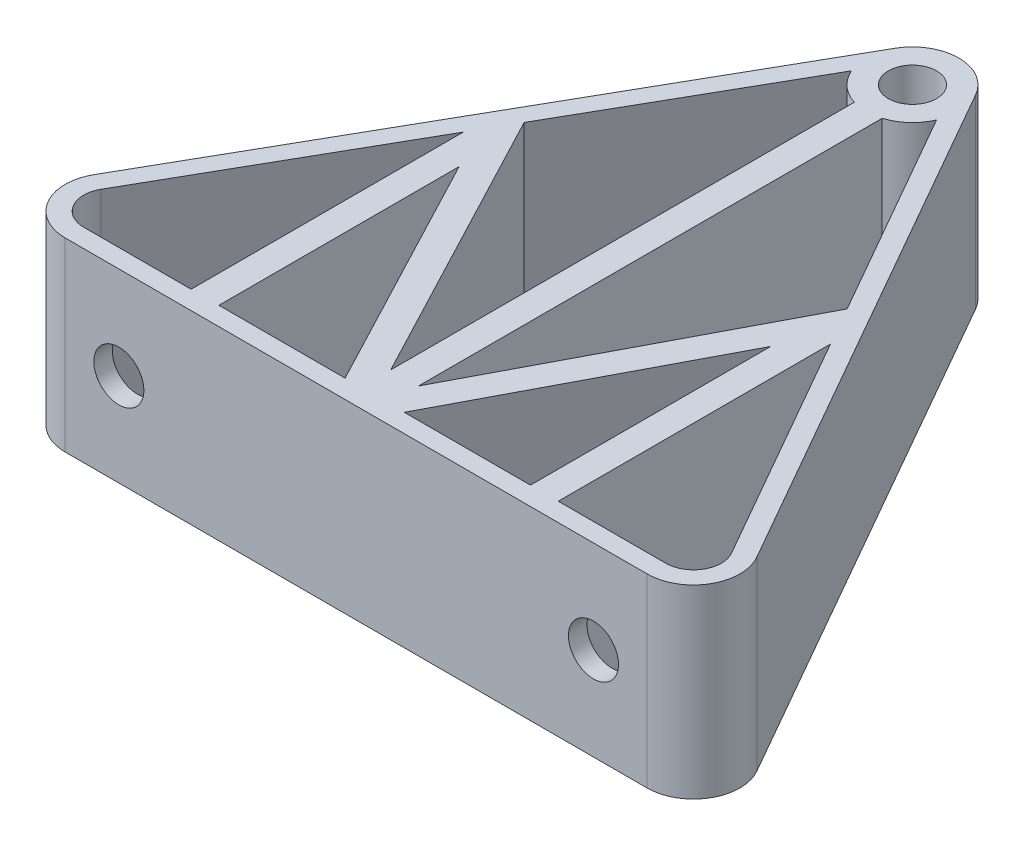
from build123d import *

# Parameters (mm, degrees)
SALIENTE_EXTRUIR1_DEPTH = 20
CORTAR_EXTRUIR1_START   = -20
CORTAR_EXTRUIR1_DEPTH   = 20
CROQUIS3_R              = 2.6
CORTAR_EXTRUIR2_DEPTH   = 20
CROQUIS4_R              = 2.7
CORTAR_EXTRUIR3_DEPTH   = 20


with BuildPart() as part:
    # Croquis1 → Saliente-Extruir1 (new body)
    with BuildSketch(Plane(origin=(0, 0, 0), x_dir=(1, 0, 0), z_dir=(0, 1, 0))):
        with BuildLine():
            Line((-4.342546511, 2.47836434), (-35.731971676, -52.52163566))
            ThreePointArc((-35.731971676, -52.52163566), (-35.713301997, -57.510794525), (-31.389425165, -60))
            Line((-31.389425165, -60), (31.389425165, -60))
            ThreePointArc((31.389425165, -60), (35.713301997, -57.510794525), (35.731971676, -52.52163566))
            Line((35.731971676, -52.52163566), (4.342546511, 2.47836434))
            ThreePointArc((4.342546511, 2.47836434), (0, 5), (-4.342546511, 2.47836434))
        make_face()
    extrude(amount=SALIENTE_EXTRUIR1_DEPTH)

    # Croquis2 → Cortar-Extruir1 (cut)
    with BuildSketch(Plane(origin=(0, 20, 0), x_dir=(1, 0, 0), z_dir=(0, 1, 0)).offset(CORTAR_EXTRUIR1_START)):
        with BuildLine():
            Line((-19.800240489, -58), (-19.800240489, -28.641255076))
            Line((-19.800240489, -28.641255076), (-33.994953072, -53.512981396))
            ThreePointArc((-33.994953072, -53.512981396), (-33.983751264, -56.506476715), (-31.389425165, -58))
            Line((-31.389425165, -58), (-19.800240489, -58))
        make_face()
        Polygon((-16.800240489, -58), (-3.194307375, -58), (-16.800240489, -32.094821088), align=None)
        with BuildLine():
            Line((-1.5, -54.77410323), (-1.5, -4.769696007))
            ThreePointArc((-1.5, -4.769696007), (-3.347002716, -3.714508422), (-4.588219379, -1.987018604))
            Line((-4.588219379, -1.987018604), (-17.417918454, -24.466992207))
            Line((-17.417918454, -24.466992207), (-1.5, -54.77410323))
        make_face()
        with BuildLine():
            ThreePointArc((4.588219379, -1.987018604), (3.347002716, -3.714508422), (1.5, -4.769696007))
            Line((1.5, -4.769696007), (1.5, -54.77410323))
            Line((1.5, -54.77410323), (17.417918454, -24.466992207))
            Line((17.417918454, -24.466992207), (4.588219379, -1.987018604))
        make_face()
        with BuildLine():
            Line((33.994953072, -53.512981396), (19.800240489, -28.641255076))
            Line((19.800240489, -28.641255076), (19.800240489, -58))
            Line((19.800240489, -58), (31.389425165, -58))
            ThreePointArc((31.389425165, -58), (33.983751264, -56.506476715), (33.994953072, -53.512981396))
        make_face()
        Polygon((16.800240489, -32.094821088), (3.194307375, -58), (16.800240489, -58), align=None)
    extrude(amount=CORTAR_EXTRUIR1_DEPTH, mode=Mode.SUBTRACT)

    # Croquis3 → Cortar-Extruir2 (cut)
    with BuildSketch(Plane(origin=(0, 20, 0), x_dir=(1, 0, 0), z_dir=(0, 1, 0))):
        with Locations(Location((0, 0, 0), (0, 0, 270))):
            Circle(CROQUIS3_R)
    extrude(amount=-CORTAR_EXTRUIR2_DEPTH, mode=Mode.SUBTRACT)

    # Croquis4 → Cortar-Extruir3 (cut)
    with BuildSketch(Plane(origin=(0, 0, 58), x_dir=(-1, 0, 0), z_dir=(0, 0, -1))):
        with Locations((25.594832827, 10)):
            Circle(CROQUIS4_R)
        with Locations((-25.594832827, 10)):
            Circle(CROQUIS4_R)
    extrude(amount=-CORTAR_EXTRUIR3_DEPTH, mode=Mode.SUBTRACT)


solid = part.part
